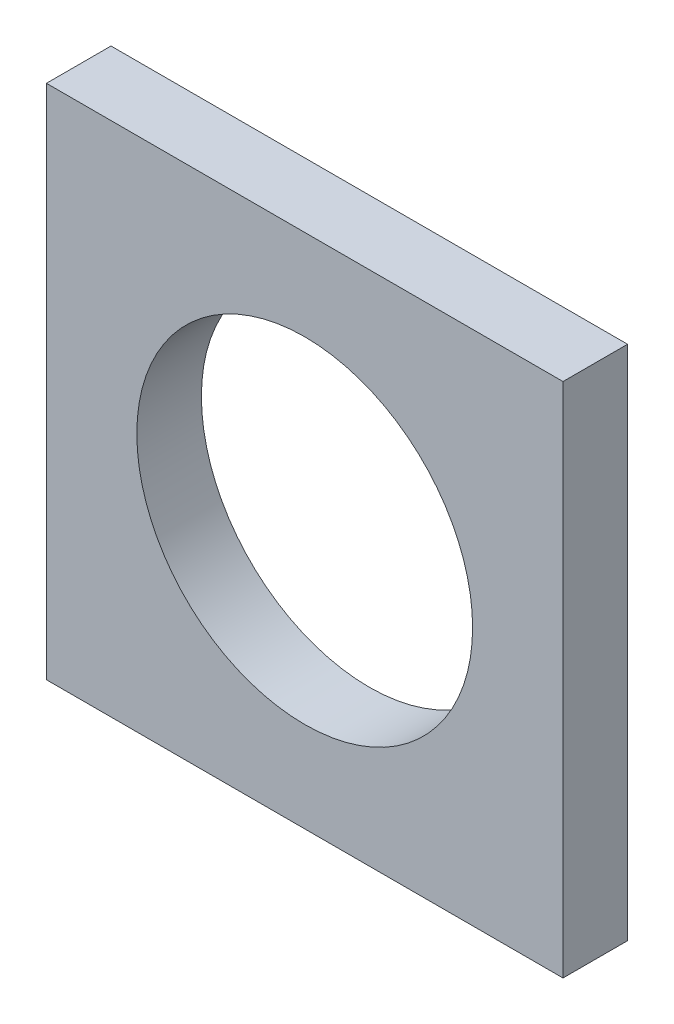
from build123d import *

# Parameters (mm, degrees)
SKETCH1_W           = 20
SKETCH1_H           = 20
SKETCH1_R           = 6.5
BOSS_EXTRUDE1_DEPTH = 2.5


with BuildPart() as part:
    # Sketch1 → Boss-Extrude1 (new body)
    with BuildSketch(Plane.XY):
        Rectangle(SKETCH1_W, SKETCH1_H)
        Circle(SKETCH1_R, mode=Mode.SUBTRACT)
    extrude(amount=BOSS_EXTRUDE1_DEPTH)


solid = part.part
